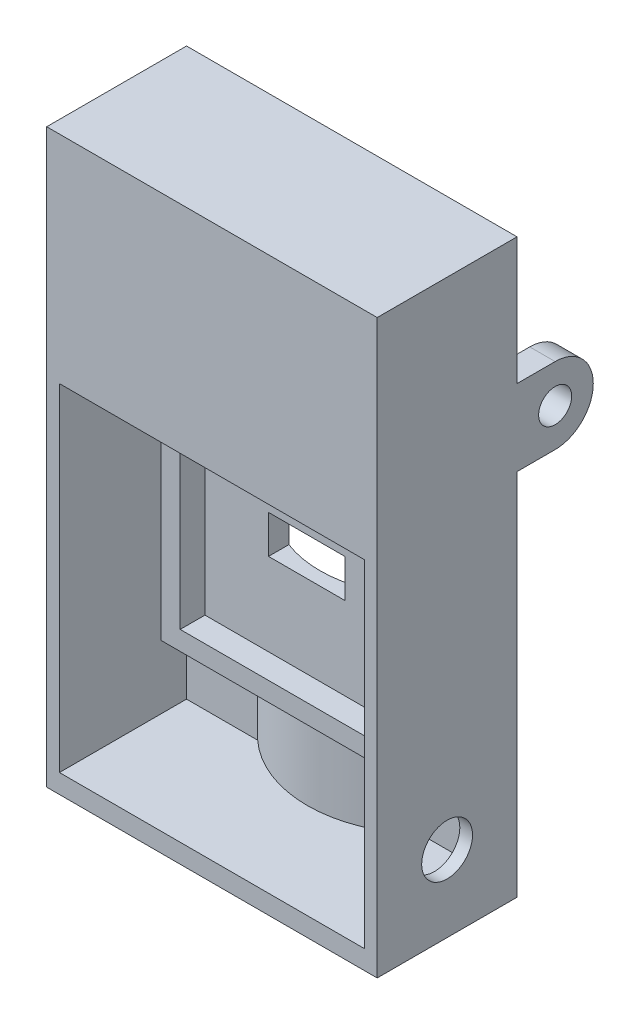
from build123d import *

# Parameters (mm, degrees)
SKETCH1_W           = 26
SKETCH1_H           = 45
BOSS_EXTRUDE1_DEPTH = 11
SKETCH2_R           = 8.45
CUT_EXTRUDE1_DEPTH  = 28
CUT_EXTRUDE2_DEPTH  = 26.5
SKETCH5_W           = 6
SKETCH5_H           = 3
CUT_EXTRUDE3_DEPTH  = 53.509522946
BOSS_EXTRUDE4_START = 19
BOSS_EXTRUDE4_DEPTH = 19
SKETCH8_W           = 16
SKETCH8_H           = 16
CUT_EXTRUDE7_DEPTH  = 1.95
SKETCH9_W           = 6
SKETCH9_H           = 3
CUT_EXTRUDE8_DEPTH  = 53.502404707
SKETCH10_R          = 2
CUT_EXTRUDE9_DEPTH  = 4
SKETCH11_R          = 1.3
BOSS_EXTRUDE5_DEPTH = 26
SKETCH13_W          = 22
SKETCH13_H          = 12.79225404
CUT_EXTRUDE11_DEPTH = 54.122499941


with BuildPart() as part:
    # Sketch1 → Boss-Extrude1 (new body)
    with BuildSketch(Plane.XY):
        with Locations((13, -22.5)):
            Rectangle(SKETCH1_W, SKETCH1_H)
    extrude(amount=BOSS_EXTRUDE1_DEPTH)

    # Sketch2 → Cut-Extrude1 (cut)
    with BuildSketch(Plane.XZ.offset(45)):
        with Locations((13, -5.95)):
            Circle(SKETCH2_R)
    extrude(amount=-CUT_EXTRUDE1_DEPTH, mode=Mode.SUBTRACT)

    # Sketch4 → Cut-Extrude2 (cut)
    with BuildSketch(Plane(origin=(0, -43.5, 0), x_dir=(-1, 0, 0), z_dir=(0, -1, 0))):
        with BuildLine():
            Line((-1, -11), (-1, -1))
            Line((-1, -1), (-6.596875763, -1))
            ThreePointArc((-6.596875763, -1), (-13, -3.5), (-19.403124237, -1))
            Line((-19.403124237, -1), (-25, -1))
            Line((-25, -1), (-25, -11))
            Line((-25, -11), (-1, -11))
        make_face()
    extrude(amount=-CUT_EXTRUDE2_DEPTH, mode=Mode.SUBTRACT)

    # Sketch5 → Cut-Extrude3 (cut, through all)
    with BuildSketch(Plane.XY.offset(3.5)):
        with Locations((13, -26.5)):
            Rectangle(SKETCH5_W, SKETCH5_H)
    extrude(amount=-CUT_EXTRUDE3_DEPTH, mode=Mode.SUBTRACT)

    # Sketch6 → Boss-Extrude4 (add)
    with BuildSketch(Plane.XZ.offset(17).offset(BOSS_EXTRUDE4_START)):
        with BuildLine():
            Line((6.596875763, 1), (3.5, 1))
            Line((3.5, 1), (3.5, 5.5))
            Line((3.5, 5.5), (22.5, 5.5))
            Line((22.5, 5.5), (22.5, 1))
            Line((22.5, 1), (19.403124237, 1))
            ThreePointArc((19.403124237, 1), (13, 3.5), (6.596875763, 1))
        make_face()
    extrude(amount=-BOSS_EXTRUDE4_DEPTH)

    # Sketch8 → Cut-Extrude7 (cut)
    with BuildSketch(Plane.XY.offset(5.5)):
        with Locations((13, -26.5)):
            Rectangle(SKETCH8_W, SKETCH8_H)
    extrude(amount=-CUT_EXTRUDE7_DEPTH, mode=Mode.SUBTRACT)

    # Sketch9 → Cut-Extrude8 (cut, through all)
    with BuildSketch(Plane.XY.offset(3.55)):
        with Locations((13, -26.5)):
            Rectangle(SKETCH9_W, SKETCH9_H)
    extrude(amount=-CUT_EXTRUDE8_DEPTH, mode=Mode.SUBTRACT)

    # Sketch10 → Cut-Extrude9 (cut)
    with BuildSketch(Plane(origin=(26, 0, 0), x_dir=(0, 0, -1), z_dir=(1, 0, 0))):
        with Locations(Location((-5.5, -39, 0), (0, 0, 90))):
            Circle(SKETCH10_R)
    extrude(amount=-CUT_EXTRUDE9_DEPTH, mode=Mode.SUBTRACT)

    # Sketch11 → Boss-Extrude5 (add)
    with BuildSketch(Plane(origin=(26, 0, 0), x_dir=(0, 0, -1), z_dir=(1, 0, 0))):
        with BuildLine():
            Line((0, -10), (3, -10))
            ThreePointArc((3, -10), (6, -13), (3, -16))
            Line((3, -16), (0, -16))
            Line((0, -16), (0, -10))
        make_face()
        with Locations(Location((3, -13, 0), (0, 0, 90))):
            Circle(SKETCH11_R, mode=Mode.SUBTRACT)
    extrude(amount=-BOSS_EXTRUDE5_DEPTH)

    # Sketch13 → Cut-Extrude11 (cut, through all)
    with BuildSketch(Plane(origin=(0, 0, 0), x_dir=(-1, 0, 0), z_dir=(0, 0, -1))):
        with Locations((-13, -11.769971003)):
            Rectangle(SKETCH13_W, SKETCH13_H)
    extrude(amount=CUT_EXTRUDE11_DEPTH, mode=Mode.SUBTRACT)


solid = part.part
